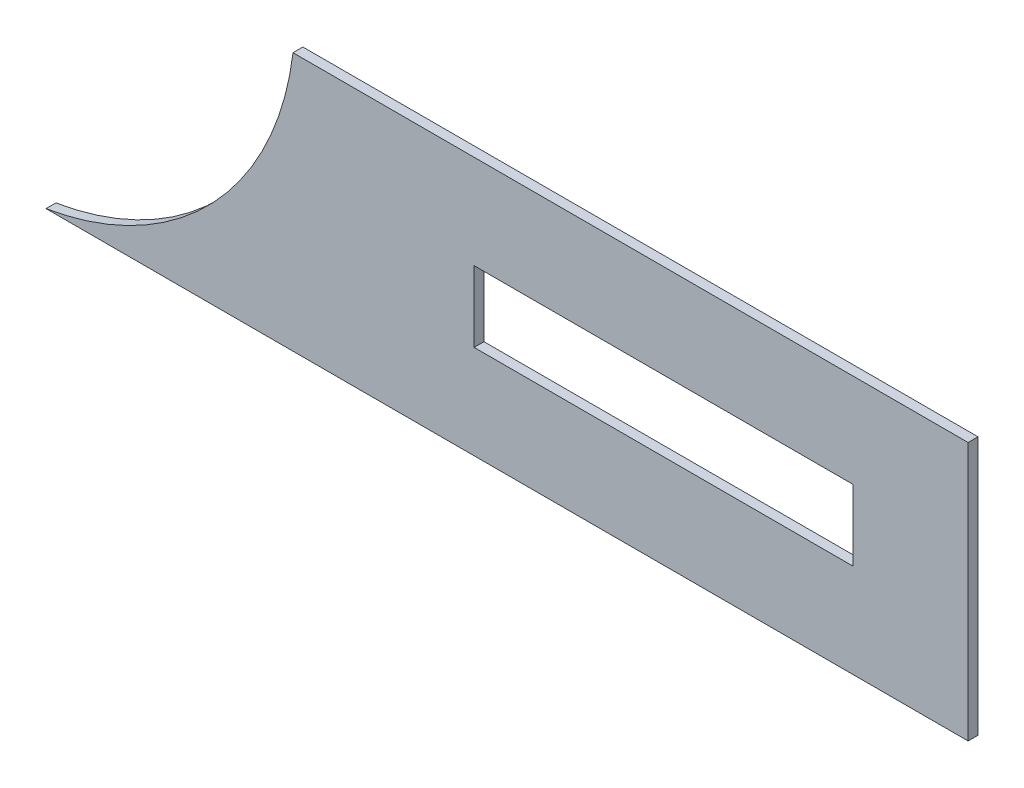
from build123d import *

# Parameters (mm, degrees)
SKETCH_1_W      = 23
SKETCH_1_H      = 4.3
EXTRUDE_1_DEPTH = 0.6


with BuildPart() as part:
    # Эскиз1 → Бобышка-Вытянуть1 (new body)
    with BuildSketch(Plane.XY):
        with BuildLine():
            Line((0, 0), (56, 0))
            Line((56, 0), (56, 15.7))
            Line((56, 15.7), (15, 15.7))
            ThreePointArc((15, 15.7), (10.112556238, 5.353927161), (0, 0))
        make_face()
        with Locations((37.5, 7.85)):
            Rectangle(SKETCH_1_W, SKETCH_1_H, mode=Mode.SUBTRACT)
    extrude(amount=EXTRUDE_1_DEPTH)


solid = part.part
